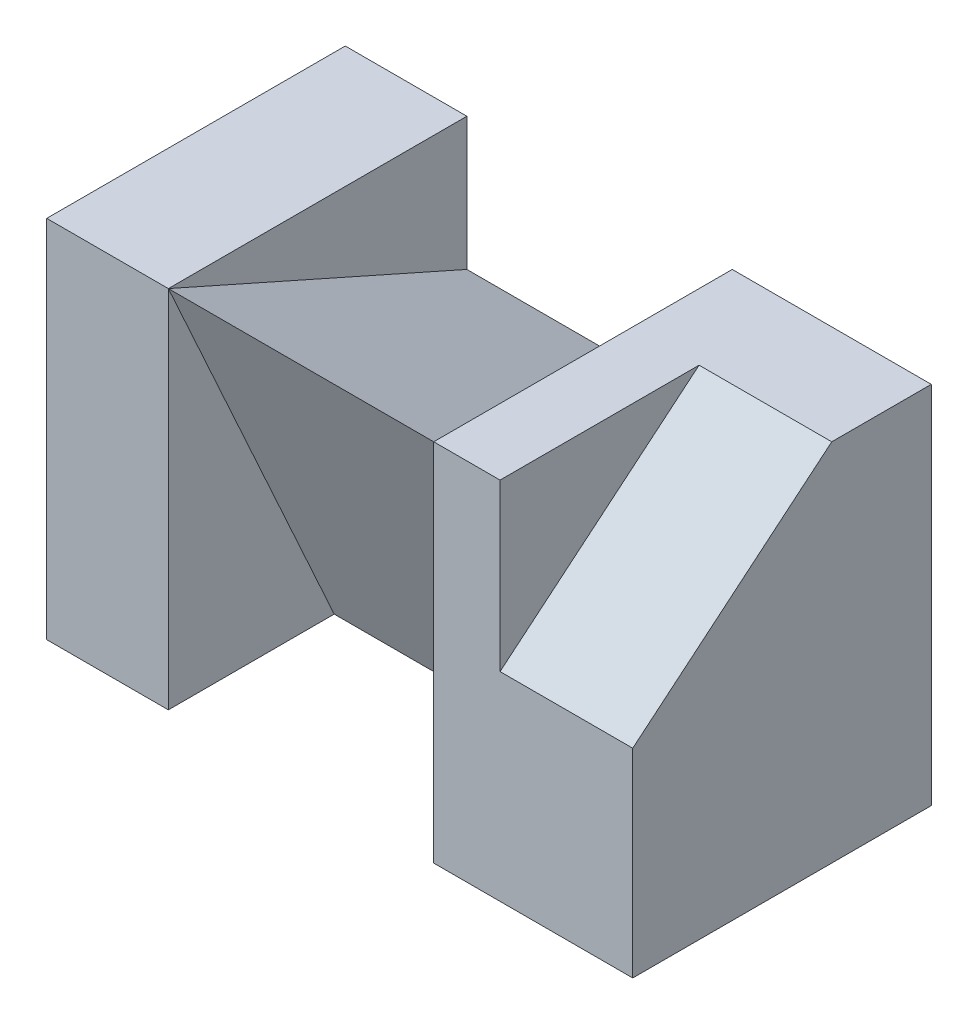
from build123d import *

# Parameters (mm, degrees)
SKETCH1_W             = 11
SKETCH1_H             = 27
BOSS_EXTRUDE1_DEPTH   = 33
SKETCH1_W_2           = 18
BOSS_EXTRUDE1_2_DEPTH = 33
BOSS_EXTRUDE2_DEPTH   = 13
SKETCH1_5_W           = 24
SKETCH1_5_H           = 27
BOSS_EXTRUDE4_DEPTH   = 33
CUT_EXTRUDE1_DEPTH    = 24
CUT_EXTRUDE2_DEPTH    = 12


with BuildPart() as part:
    # Sketch1 → Boss-Extrude1 (new body)
    with BuildSketch(Plane(origin=(0, 0, 0), x_dir=(1, 0, 0), z_dir=(0, 1, 0))):
        with Locations((-5.5, 0)):
            Rectangle(SKETCH1_W, SKETCH1_H)
    extrude(amount=BOSS_EXTRUDE1_DEPTH)

    # Sketch1<3> → Boss-Extrude2 (add)
    with BuildSketch(Plane(origin=(0, 0, 0), x_dir=(1, 0, 0), z_dir=(0, 1, 0))):
        Polygon((-24, 13.5), (-11, -13.5), (-11, 13.5), align=None)
    extrude(amount=BOSS_EXTRUDE2_DEPTH)



with BuildPart() as body_2:
    # Sketch1 → Boss-Extrude1 2 (new body)
    with BuildSketch(Plane(origin=(0, 0, 0), x_dir=(1, 0, 0), z_dir=(0, 1, 0))):
        with Locations((33, 0)):
            Rectangle(SKETCH1_W_2, SKETCH1_H)
    extrude(amount=BOSS_EXTRUDE1_2_DEPTH)


with BuildPart() as part_1:
    add(part.part)

    add(body_2.part)  # Boss-Extrude4 merges body 2
    # Sketch1<5> → Boss-Extrude4 (add)
    with BuildSketch(Plane(origin=(0, 0, 0), x_dir=(1, 0, 0), z_dir=(0, 1, 0))):
        with Locations((12, 0)):
            Rectangle(SKETCH1_5_W, SKETCH1_5_H)
    extrude(amount=BOSS_EXTRUDE4_DEPTH)

    # Sketch3 → Cut-Extrude1 (cut)
    with BuildSketch(Plane.ZY.offset(-24)):
        Polygon((13.5, 33), (-13.5, 33), (-13.5, 21), align=None)
        Polygon((13.5, 0), (13.5, 33), (-1.5, 0), align=None)
    extrude(amount=CUT_EXTRUDE1_DEPTH, mode=Mode.SUBTRACT)

    # Sketch4 → Cut-Extrude2 (cut)
    with BuildSketch(Plane(origin=(42, 0, 0), x_dir=(0, 0, -1), z_dir=(1, 0, 0))):
        Polygon((4.5, 33), (-13.5, 18), (-13.5, 33), align=None)
    extrude(amount=-CUT_EXTRUDE2_DEPTH, mode=Mode.SUBTRACT)


solid = part_1.part
